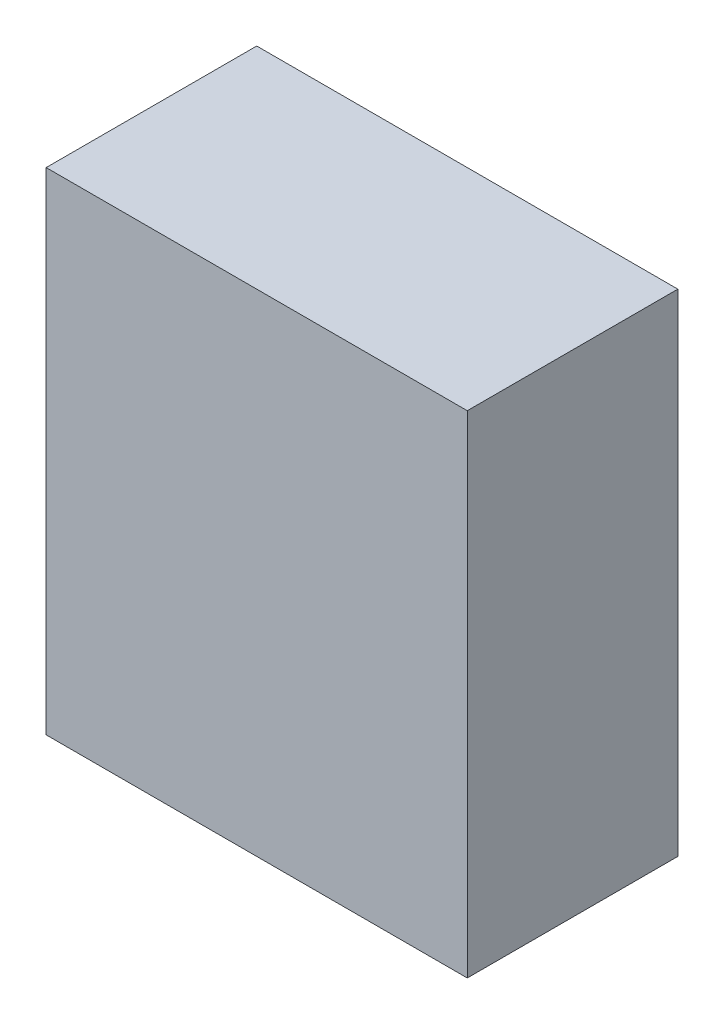
from build123d import *

# Parameters (mm, degrees)
SKETCH_1_W      = 60
SKETCH_1_H      = 70
EXTRUDE_2_DEPTH = 30


with BuildPart() as part:
    # 草圖1 → 填料-伸長2 (new body)
    with BuildSketch(Plane.XY):
        with Locations((-24.651870655, -31.361458333)):
            Rectangle(SKETCH_1_W, SKETCH_1_H)
    extrude(amount=EXTRUDE_2_DEPTH)


solid = part.part
